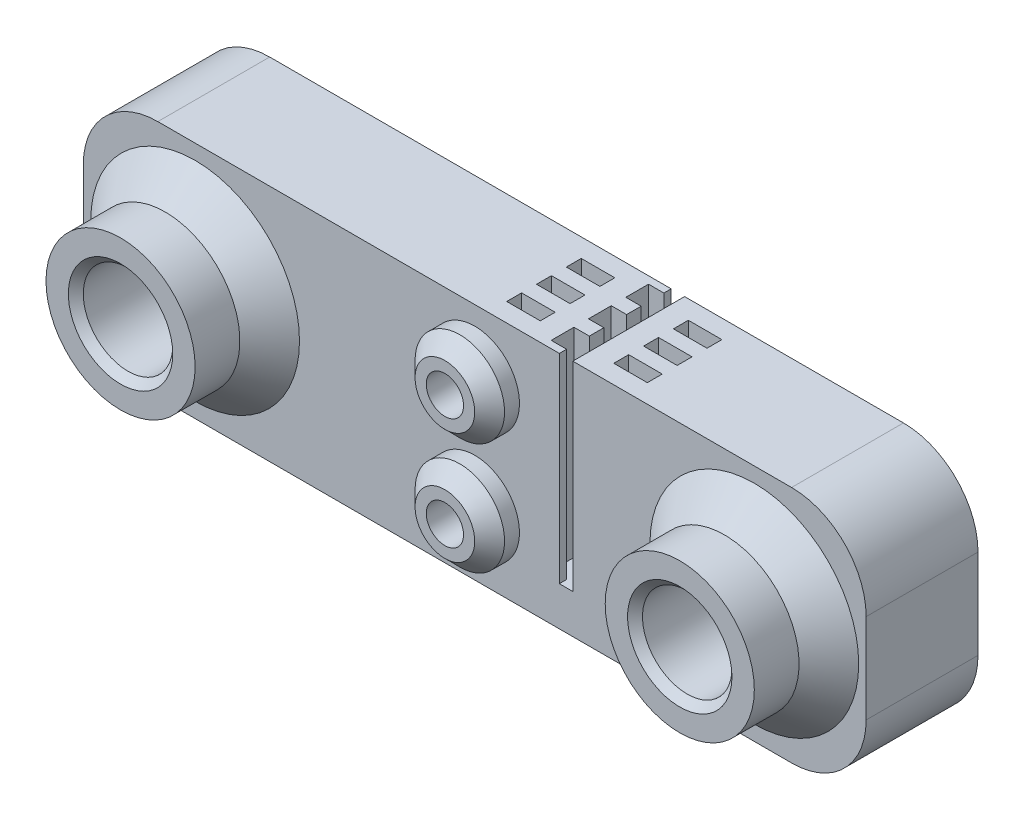
from build123d import *

# Parameters (mm, degrees)
SKETCH_1_R          = 6
EXTRUDE_1_DEPTH     = 7.5
CUT_EXTRUDE_1_DEPTH = 26.75
SKETCH_4_W          = 4.5
SKETCH_4_H          = 2
CUT_EXTRUDE_2_DEPTH = 7
SKETCH_5_R          = 10
SKETCH_5_R_2        = 6
EXTRUDE_2_DEPTH     = 10
CHAMFER_1_SIZE      = 4
CHAMFER_2_SIZE      = 1
SKETCH_6_R          = 1.5
CUT_EXTRUDE_3_DEPTH = 61.309617807
SKETCH_8_R          = 2.5
CUT_EXTRUDE_4_DEPTH = 8
EXTRUDE_START       = 4
SKETCH_9_R          = 6
SKETCH_9_R_2        = 2.5
EXTRUDE_3_DEPTH     = 4
CHAMFER_4_SIZE      = 2


with BuildPart() as part:
    # 草图1 → 凸台-拉伸1 (new, symmetric)
    with BuildSketch(Plane.XY):
        with BuildLine():
            Line((-42.5, 16), (42.5, 16))
            ThreePointArc((42.5, 16), (49.571067812, 13.071067812), (52.5, 6))
            Line((52.5, 6), (52.5, -6))
            ThreePointArc((52.5, -6), (49.571067812, -13.071067812), (42.5, -16))
            Line((42.5, -16), (-42.5, -16))
            ThreePointArc((-42.5, -16), (-49.571067812, -13.071067812), (-52.5, -6))
            Line((-52.5, -6), (-52.5, 6))
            ThreePointArc((-52.5, 6), (-49.571067812, 13.071067812), (-42.5, 16))
        make_face()
        with Locations((-37.5, 0)):
            Circle(SKETCH_1_R, mode=Mode.SUBTRACT)
        with Locations((37.5, 0)):
            Circle(SKETCH_1_R, mode=Mode.SUBTRACT)
    extrude(amount=EXTRUDE_1_DEPTH, both=True)

    # 草图2 → 切除-拉伸1 (cut)
    with BuildSketch(Plane(origin=(0, 16, 0), x_dir=(1, 0, 0), z_dir=(0, 1, 0))):
        Polygon((13.15, 7.5), (11.35, 7.5), (11.35, 6.52), (9.29, 6.52), (9.29, 3.47), (11.35, 3.47), (11.35, 1.52), (9.29, 1.52), (9.29, -1.53), (11.35, -1.53), (11.35, -3.48), (9.29, -3.48), (9.29, -6.53), (11.35, -6.53), (11.35, -7.5), (13.15, -7.5), align=None)
    extrude(amount=-CUT_EXTRUDE_1_DEPTH, mode=Mode.SUBTRACT)

    # 草图4 → 切除-拉伸2 (cut)
    with BuildSketch(Plane(origin=(0, 16, 0), x_dir=(1, 0, 0), z_dir=(0, 1, 0))):
        with Locations((4.04, 4)):
            Rectangle(SKETCH_4_W, SKETCH_4_H)
        with Locations((4.04, 0)):
            Rectangle(SKETCH_4_W, SKETCH_4_H)
        with Locations((4.04, -4)):
            Rectangle(SKETCH_4_W, SKETCH_4_H)
        with Locations((18.4, 4)):
            Rectangle(SKETCH_4_W, SKETCH_4_H)
        with Locations((18.4, 0)):
            Rectangle(SKETCH_4_W, SKETCH_4_H)
        with Locations((18.4, -4)):
            Rectangle(SKETCH_4_W, SKETCH_4_H)
    extrude(amount=-CUT_EXTRUDE_2_DEPTH, mode=Mode.SUBTRACT)

    # 草图5 → 凸台-拉伸2 (add)
    # profile 1 of 2: a face of its own
    with BuildSketch(Plane.XY.offset(7.5)):
        with Locations(Location((-37.5, 0, 0), (0, 0, 180))):
            Circle(SKETCH_5_R)
        with Locations((-37.5, 0)):
            Circle(SKETCH_5_R_2, mode=Mode.SUBTRACT)
    # profile 2 of 2: a face of its own
    with BuildSketch(Plane.XY.offset(7.5)):
        with Locations(Location((37.5, 0, 0), (0, 0, 180))):
            Circle(SKETCH_5_R)
        with Locations((37.5, 0)):
            Circle(SKETCH_5_R_2, mode=Mode.SUBTRACT)
    extrude(amount=EXTRUDE_2_DEPTH)

    # 倒角1
    chamfer_1_edges = [part.edges().sort_by_distance(p)[0] for p in [
        (-27.5, 0, 7.5),
        (47.5, 0, 7.5),
    ]]
    chamfer(chamfer_1_edges, length=CHAMFER_1_SIZE)

    # 倒角2
    chamfer_2_edges = [part.edges().sort_by_distance(p)[0] for p in [
        (-43.5, 0, 17.5),
        (31.5, 0, 17.5),
    ]]
    chamfer(chamfer_2_edges, length=CHAMFER_2_SIZE)

    # 草图6 → 切除-拉伸3 (cut, through all)
    with BuildSketch(Plane(origin=(0, 0, -7.5), x_dir=(-1, 0, 0), z_dir=(0, 0, -1))):
        with Locations((0, 7.5)):
            Circle(SKETCH_6_R)
        with Locations((0, -7.5)):
            Circle(SKETCH_6_R)
    extrude(amount=-CUT_EXTRUDE_3_DEPTH, mode=Mode.SUBTRACT)

    # 草图8 → 切除-拉伸4 (cut)
    with BuildSketch(Plane.XY.offset(7.5)):
        with Locations((0, 7.5)):
            Circle(SKETCH_8_R)
        with Locations((0, -7.5)):
            Circle(SKETCH_8_R)
    extrude(amount=-CUT_EXTRUDE_4_DEPTH, mode=Mode.SUBTRACT)

    # 草图9 → 凸台-拉伸3 (add)
    # profile 1 of 2: a face of its own
    with BuildSketch(Plane.XY.offset(7.5).offset(EXTRUDE_START)):
        with Locations(Location((0, 7.5, 0), (0, 0, 180))):
            Circle(SKETCH_9_R)
        with Locations((0, 7.5)):
            Circle(SKETCH_9_R_2, mode=Mode.SUBTRACT)
    # profile 2 of 2: a face of its own
    with BuildSketch(Plane.XY.offset(7.5).offset(EXTRUDE_START)):
        with Locations(Location((0, -7.5, 0), (0, 0, 180))):
            Circle(SKETCH_9_R)
        with Locations((0, -7.5)):
            Circle(SKETCH_9_R_2, mode=Mode.SUBTRACT)
    extrude(amount=-EXTRUDE_3_DEPTH)

    # 倒角4
    chamfer_4_edges = [part.edges().sort_by_distance(p)[0] for p in [
        (6, 7.5, 11.5),
        (6, -7.5, 11.5),
    ]]
    chamfer(chamfer_4_edges, length=CHAMFER_4_SIZE)


solid = part.part
